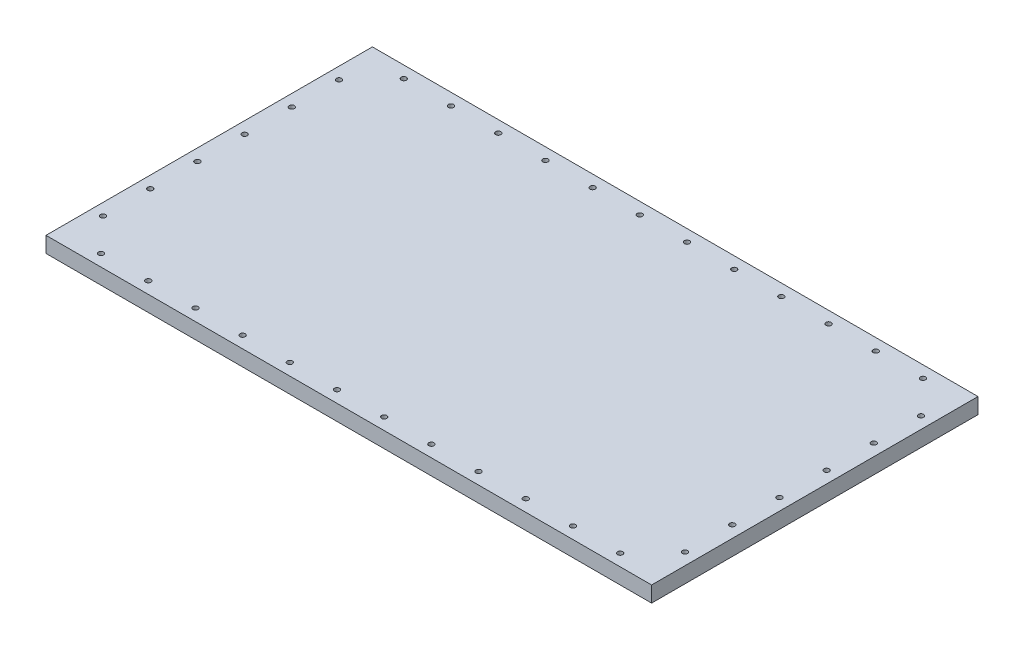
from build123d import *

# Parameters (mm, degrees)
SKETCH1_W                                         = 977.9
SKETCH1_H                                         = 25.4
BOSS_EXTRUDE1_DEPTH                               = 527.05
CSK_FOR_5_16_FLAT_HEAD_MACHINE_SCREW3_D           = 8.4328
CSK_FOR_5_16_FLAT_HEAD_MACHINE_SCREW3_CSINK_D     = 16.129
CSK_FOR_5_16_FLAT_HEAD_MACHINE_SCREW3_CSINK_ANGLE = 82
CSK_FOR_5_16_FLAT_HEAD_MACHINE_SCREW4_D           = 8.4328
CSK_FOR_5_16_FLAT_HEAD_MACHINE_SCREW4_CSINK_D     = 16.129
CSK_FOR_5_16_FLAT_HEAD_MACHINE_SCREW4_CSINK_ANGLE = 82


with BuildPart() as part:
    # Sketch1 → Boss-Extrude1 (new body)
    with BuildSketch(Plane.XY):
        Rectangle(SKETCH1_W, SKETCH1_H)
    extrude(amount=BOSS_EXTRUDE1_DEPTH)

    # CSK for 5/16 Flat Head Machine Screw3 (through all)
    with Locations(Plane(origin=(0, -12.7, 0), x_dir=(-1, 0, 0), z_dir=(0, -1, 0))):
        with Locations((419.1, -508), (342.9, -508), (266.7, -508), (190.5, -508), (114.3, -508), (38.1, -508), (-38.1, -508), (-114.3, -508), (-190.5, -508), (-266.7, -508), (419.1, -19.05), (342.9, -19.05), (266.7, -19.05), (190.5, -19.05), (114.3, -19.05), (38.1, -19.05), (-38.1, -19.05), (-114.3, -19.05), (-190.5, -19.05), (-266.7, -19.05), (-342.9, -508), (-342.9, -19.05), (-419.1, -508), (-419.1, -19.05)):
            CounterSinkHole(CSK_FOR_5_16_FLAT_HEAD_MACHINE_SCREW3_D / 2, CSK_FOR_5_16_FLAT_HEAD_MACHINE_SCREW3_CSINK_D / 2, counter_sink_angle=CSK_FOR_5_16_FLAT_HEAD_MACHINE_SCREW3_CSINK_ANGLE)

    # CSK for 5/16 Flat Head Machine Screw4 (through all)
    with Locations(Plane(origin=(0, -12.7, 0), x_dir=(-1, 0, 0), z_dir=(0, -1, 0))):
        with Locations((469.9, -454.025), (469.9, -377.825), (469.9, -301.625), (469.9, -225.425), (469.9, -149.225), (469.9, -73.025), (-469.9, -454.025), (-469.9, -377.825), (-469.9, -301.625), (-469.9, -225.425), (-469.9, -149.225), (-469.9, -73.025)):
            CounterSinkHole(CSK_FOR_5_16_FLAT_HEAD_MACHINE_SCREW4_D / 2, CSK_FOR_5_16_FLAT_HEAD_MACHINE_SCREW4_CSINK_D / 2, counter_sink_angle=CSK_FOR_5_16_FLAT_HEAD_MACHINE_SCREW4_CSINK_ANGLE)


solid = part.part
